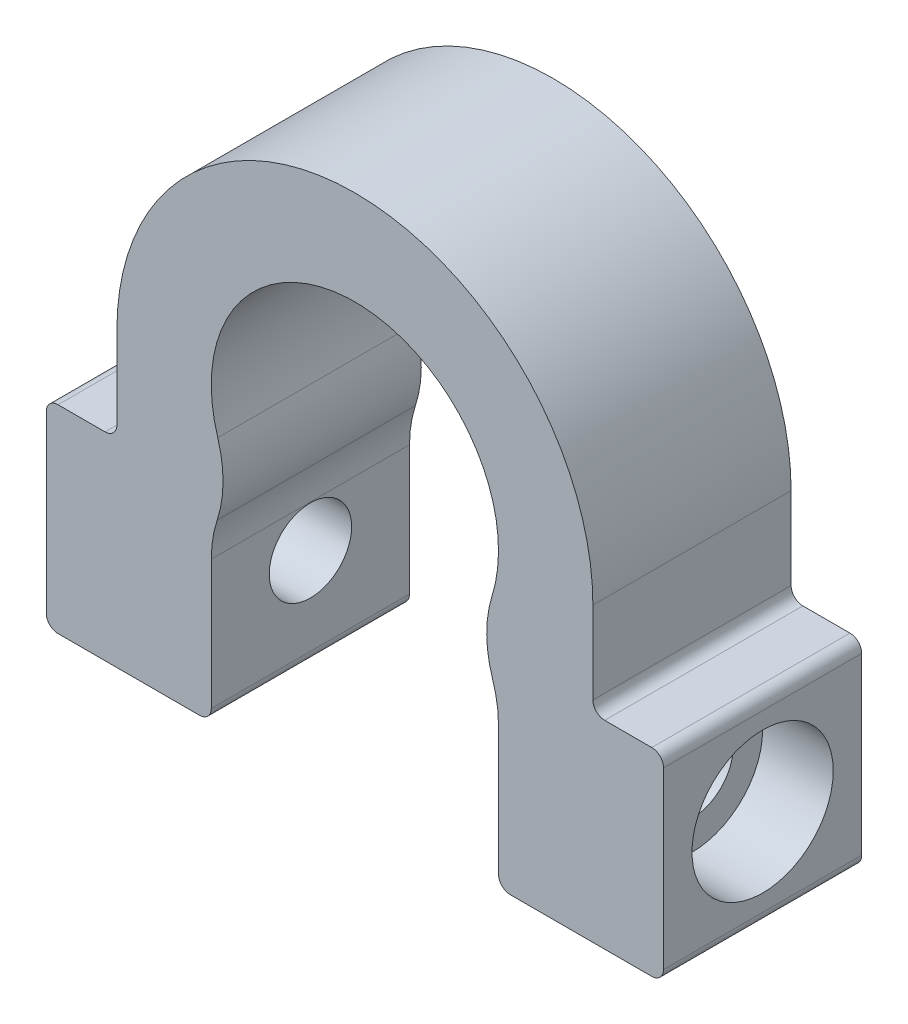
from build123d import *

# Parameters (mm, degrees)
BOSS_EXTRUDE1_DEPTH = 8.42
CUT_EXTRUDE1_REACH  = 32.206
SKETCH2_R           = 1.75
SKETCH3_R           = 3
CUT_EXTRUDE2_DEPTH  = 3
CUT_EXTRUDE3_DEPTH  = 3


with BuildPart() as part:
    # Sketch1 → Boss-Extrude1 (new body)
    with BuildSketch(Plane.XY):
        with BuildLine():
            Line((-6.1, -6.416432818), (-6.1, -11.91))
            ThreePointArc((-6.1, -11.91), (-6.246446609, -12.263553391), (-6.6, -12.41))
            Line((-6.6, -12.41), (-12.61, -12.41))
            ThreePointArc((-12.61, -12.41), (-12.963553391, -12.263553391), (-13.11, -11.91))
            Line((-13.11, -11.91), (-13.11, -4.49))
            ThreePointArc((-13.11, -4.49), (-12.963553391, -4.136446609), (-12.61, -3.99))
            Line((-12.61, -3.99), (-10.61, -3.99))
            ThreePointArc((-10.61, -3.99), (-10.256446609, -3.843553391), (-10.11, -3.49))
            Line((-10.11, -3.49), (-10.11, 0))
            ThreePointArc((-10.11, 0), (0, 10.11), (10.11, 0))
            Line((10.11, 0), (10.11, -3.49))
            ThreePointArc((10.11, -3.49), (10.256446609, -3.843553391), (10.61, -3.99))
            Line((10.61, -3.99), (12.61, -3.99))
            ThreePointArc((12.61, -3.99), (12.963553391, -4.136446609), (13.11, -4.49))
            Line((13.11, -4.49), (13.11, -11.91))
            ThreePointArc((13.11, -11.91), (12.963553391, -12.263553391), (12.61, -12.41))
            Line((12.61, -12.41), (6.6, -12.41))
            ThreePointArc((6.6, -12.41), (6.246446609, -12.263553391), (6.1, -11.91))
            Line((6.1, -11.91), (6.1, -6.416432818))
            ThreePointArc((6.1, -6.416432818), (6.037104415, -5.625863403), (5.85, -4.855183318))
            ThreePointArc((5.85, -4.855183318), (5.600165486, -3.334613501), (5.825225225, -1.810179846))
            ThreePointArc((5.825225225, -1.810179846), (0, 6.1), (-5.825225225, -1.810179846))
            ThreePointArc((-5.825225225, -1.810179846), (-5.600165486, -3.334613501), (-5.85, -4.855183318))
            ThreePointArc((-5.85, -4.855183318), (-6.037104415, -5.625863403), (-6.1, -6.416432818))
        make_face()
    extrude(amount=BOSS_EXTRUDE1_DEPTH)

    # Cut-Extrude1: up to this face of the body (flat: up to its plane)
    cut_extrude1_end = Plane(part.part.faces().sort_by_distance((-13.11, -8.2, 4.21))[0])
    # Sketch2 → Cut-Extrude1 (cut, up to the picked face)
    with BuildSketch(Plane(origin=(13.11, 0, 0), x_dir=(0, 0, -1), z_dir=(1, 0, 0)), mode=Mode.PRIVATE) as cut_extrude1_sk1:
        with Locations((-4.21, -8.2)):
            Circle(SKETCH2_R)
    cut_extrude1_tool1 = split(extrude(cut_extrude1_sk1.sketch, amount=-CUT_EXTRUDE1_REACH, mode=Mode.PRIVATE), bisect_by=cut_extrude1_end, keep=Keep.BOTH, mode=Mode.PRIVATE)
    add(cut_extrude1_tool1.solids().sort_by(Axis((13.11, -8.2, 4.21), (-1, 0, 0)))[0], mode=Mode.SUBTRACT)

    # Sketch3 → Cut-Extrude2 (cut)
    with BuildSketch(Plane(origin=(13.11, 0, 0), x_dir=(0, 0, -1), z_dir=(1, 0, 0))):
        with Locations((-4.21, -8.2)):
            Circle(SKETCH3_R)
    extrude(amount=-CUT_EXTRUDE2_DEPTH, mode=Mode.SUBTRACT)

    # Sketch4 → Cut-Extrude3 (cut)
    with BuildSketch(Plane.ZY.offset(13.11)):
        Polygon((7.443161507, -8.2), (5.826580754, -5.4), (2.593419246, -5.4), (0.976838493, -8.2), (2.593419246, -11), (5.826580754, -11), align=None)
    extrude(amount=-CUT_EXTRUDE3_DEPTH, mode=Mode.SUBTRACT)


solid = part.part
